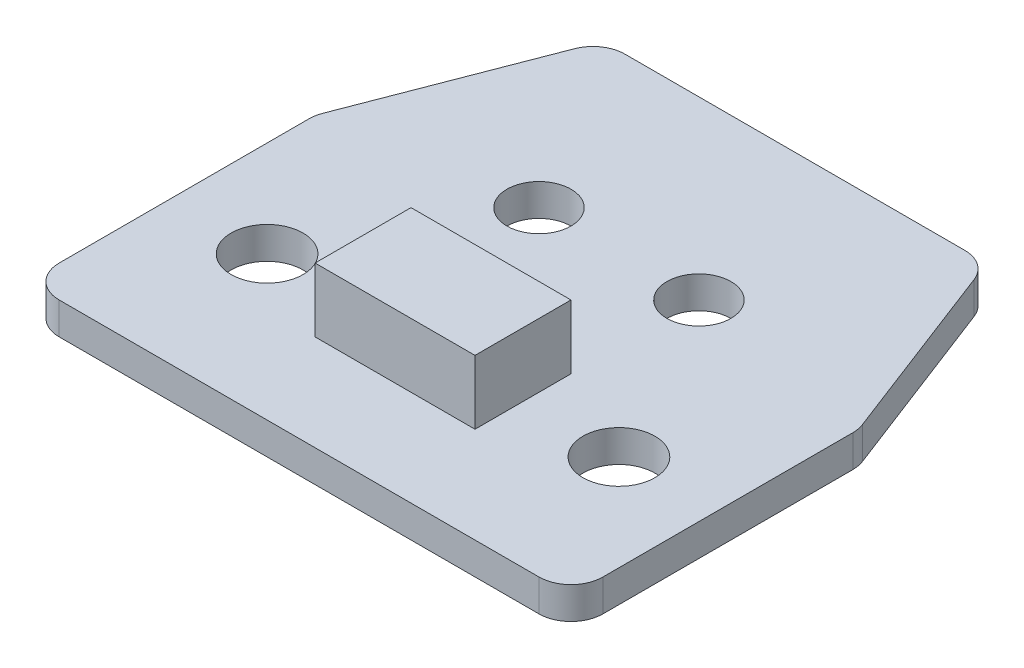
from build123d import *

# Parameters (mm, degrees)
SKETCH_1_R      = 2.25
SKETCH_1_R_2    = 2
EXTRUDE_1_DEPTH = 2
SKETCH_2_W      = 10
SKETCH_2_H      = 6
EXTRUDE_2_DEPTH = 4
FILLET_1_R      = 2


with BuildPart() as part:
    # Эскиз1 → Бобышка-Вытянуть1 (new body)
    with BuildSketch(Plane(origin=(0, 0, 0), x_dir=(1, 0, 0), z_dir=(0, 1, 0))):
        Polygon((5, 31), (0, 18), (0, 0), (34, 0), (34, 18), (29, 31), align=None)
        with Locations(Location((6, 9, 0), (0, 0, 270))):
            Circle(SKETCH_1_R, mode=Mode.SUBTRACT)
        with Locations(Location((28, 9, 0), (0, 0, 270))):
            Circle(SKETCH_1_R, mode=Mode.SUBTRACT)
        with Locations(Location((12, 20, 0), (0, 0, 270))):
            Circle(SKETCH_1_R_2, mode=Mode.SUBTRACT)
        with Locations(Location((22, 20, 0), (0, 0, 270))):
            Circle(SKETCH_1_R_2, mode=Mode.SUBTRACT)
    extrude(amount=EXTRUDE_1_DEPTH)

    # Эскиз2 → Бобышка-Вытянуть2 (add)
    with BuildSketch(Plane(origin=(0, 2, 0), x_dir=(1, 0, 0), z_dir=(0, 1, 0))):
        with Locations((17, 9)):
            Rectangle(SKETCH_2_W, SKETCH_2_H)
    extrude(amount=EXTRUDE_2_DEPTH)

    # Скругление1
    fillet_1_edges = [part.edges().sort_by_distance(p)[0] for p in [
        (34, 1, -18),
        (34, 1, 0),
        (0, 1, 0),
        (0, 1, -18),
        (5, 1, -31),
        (29, 1, -31),
    ]]
    fillet(fillet_1_edges, radius=FILLET_1_R)


solid = part.part
